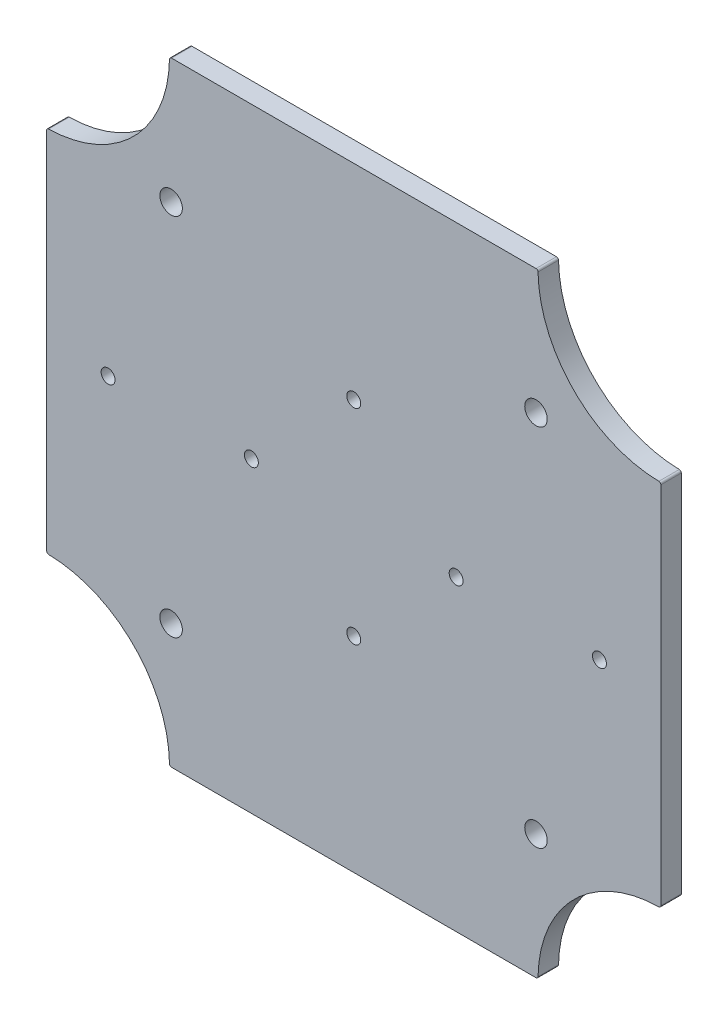
from build123d import *

# Parameters (mm, degrees)
ESQUISSE1_W                  = 150
ESQUISSE1_H                  = 150
BOSS_EXTRU_1_DEPTH           = 5
ENL_V_MAT_EXTRU_1_DEPTH      = 5
D_GAGEMENT_M31_D             = 3.4
CONG_1_R                     = 0.5
ENL_V_MAT_EXTRU_2_REACH      = 108.184
ESQUISSE6_R                  = 2.75
R_P_TITION_CIRCULAIRE1_COUNT = 4


with BuildPart() as part:
    # Esquisse1 → Boss.-Extru.1 (new body)
    with BuildSketch(Plane.XY):
        Rectangle(ESQUISSE1_W, ESQUISSE1_H)
    extrude(amount=BOSS_EXTRU_1_DEPTH)

    # Esquisse2 → Enlèv. mat.-Extru.1 (cut)
    with BuildSketch(Plane.XY.offset(5)):
        with BuildLine():
            Line((45, 75), (75, 75))
            Line((75, 75), (75, 45))
            ThreePointArc((75, 45), (53.786796564, 53.786796564), (45, 75))
        make_face()
        with BuildLine():
            Line((75, -75), (45, -75))
            ThreePointArc((45, -75), (53.786796564, -53.786796564), (75, -45))
            Line((75, -45), (75, -75))
        make_face()
        with BuildLine():
            Line((-75, -75), (-75, -45))
            ThreePointArc((-75, -45), (-53.786796564, -53.786796564), (-45, -75))
            Line((-45, -75), (-75, -75))
        make_face()
        with BuildLine():
            Line((-75, 75), (-45, 75))
            ThreePointArc((-45, 75), (-53.786796564, 53.786796564), (-75, 45))
            Line((-75, 45), (-75, 75))
        make_face()
    extrude(amount=-ENL_V_MAT_EXTRU_1_DEPTH, mode=Mode.SUBTRACT)

    # Dégagement M31 (through all)
    with Locations(Plane(origin=(0, 0, 0), x_dir=(-1, 0, 0), z_dir=(0, 0, -1))):
        with Locations((0, 25), (0, -25), (60, 0), (25, 0), (-25, 0), (-60, 0)):
            Hole(D_GAGEMENT_M31_D / 2)

    # Congé1
    cong_1_edges = [part.edges().sort_by_distance(p)[0] for p in [
        (-75, 45, 2.5),
        (-45, 75, 2.5),
        (-45, -75, 2.5),
        (-75, -45, 2.5),
        (75, -45, 2.5),
        (45, -75, 2.5),
        (75, 45, 2.5),
        (45, 75, 2.5),
    ]]
    fillet(cong_1_edges, radius=CONG_1_R)

    # Esquisse6 → Enlèv. mat.-Extru.2 (cut, up to next)
    with BuildSketch(Plane(origin=(0, 0, 0), x_dir=(-1, 0, 0), z_dir=(0, 0, -1)), mode=Mode.PRIVATE) as enl_v_mat_extru_2_sk1:
        with Locations((-44.504098636, 44.504098636)):
            Circle(ESQUISSE6_R)
    enl_v_mat_extru_2_tool1 = extrude(enl_v_mat_extru_2_sk1.sketch, amount=-ENL_V_MAT_EXTRU_2_REACH, mode=Mode.PRIVATE) & part.part
    enl_v_mat_extru_2 = enl_v_mat_extru_2_tool1.solids().sort_by_distance((44.504099, 44.504099, 0))[0]
    add(enl_v_mat_extru_2, mode=Mode.SUBTRACT)

    # Répétition circulaire1: Enlèv. mat.-Extru.2 ×4 about axis
    r_p_tition_circulaire1_axis = Axis((-0.053962748, -0.053962748, 0), (0, 0, 1))
    for i in range(1, R_P_TITION_CIRCULAIRE1_COUNT):
        add(enl_v_mat_extru_2.rotate(r_p_tition_circulaire1_axis, i * 360 / R_P_TITION_CIRCULAIRE1_COUNT), mode=Mode.SUBTRACT)


solid = part.part
